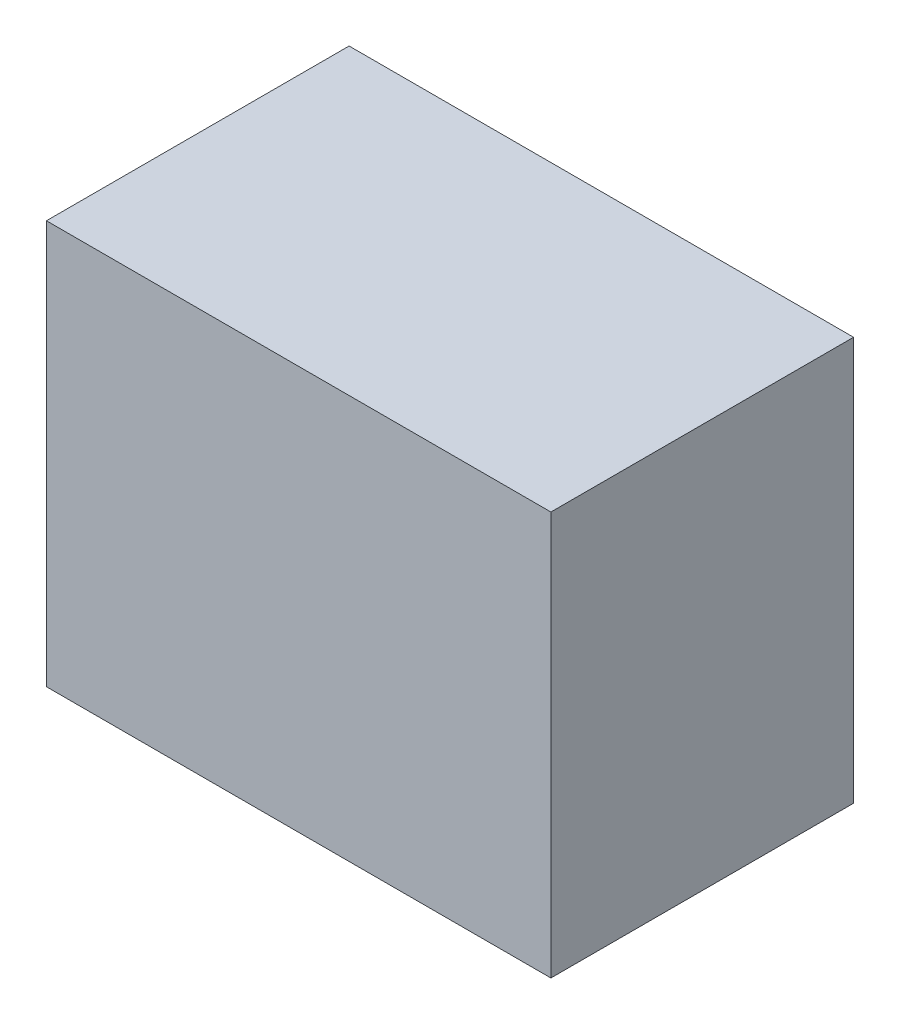
from build123d import *

# Parameters (mm, degrees)
SKETCH1_W           = 50
SKETCH1_H           = 40
BOSS_EXTRUDE1_DEPTH = 30


with BuildPart() as part:
    # Sketch1 → Boss-Extrude1 (new body)
    with BuildSketch(Plane.XY):
        with Locations((-21.900826446, 6.549586777)):
            Rectangle(SKETCH1_W, SKETCH1_H)
    extrude(amount=BOSS_EXTRUDE1_DEPTH)


solid = part.part
